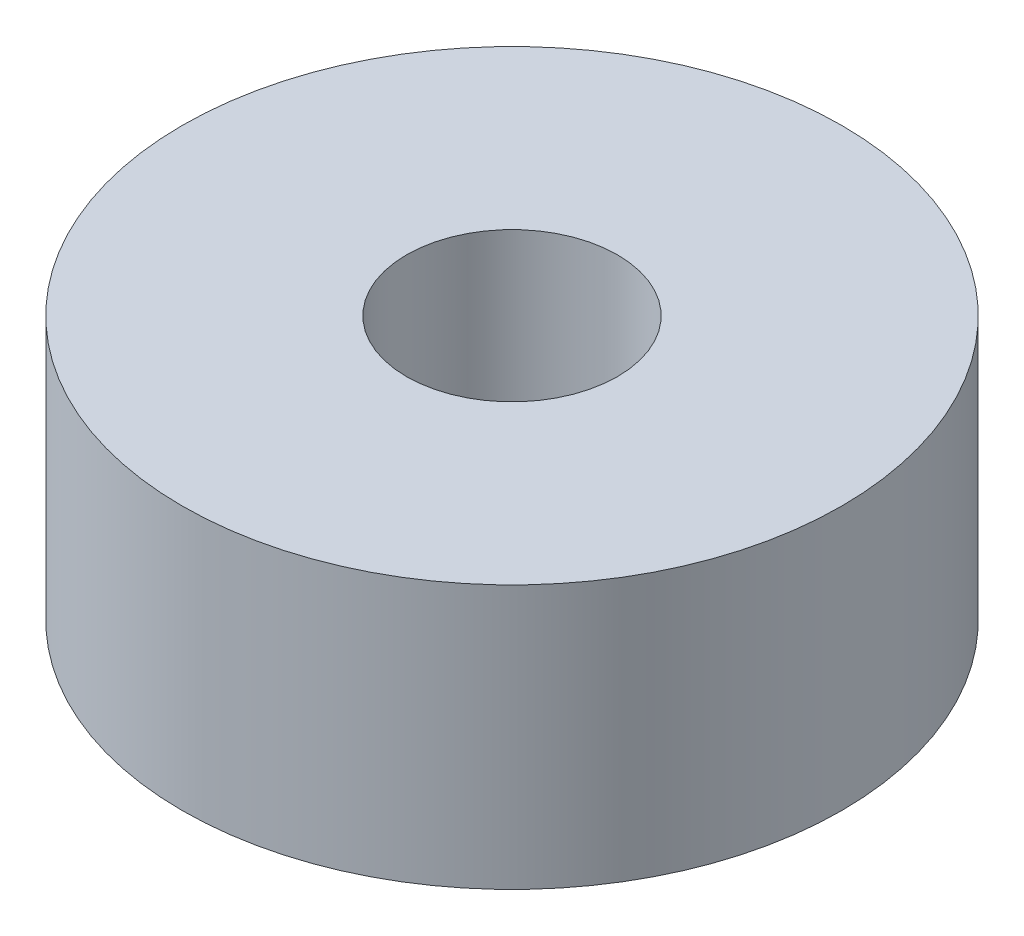
from build123d import *

# Parameters (mm, degrees)
SKETCH_1_R          = 2.5
EXTRUDE_1_DEPTH     = 2
SKETCH_2_R          = 0.8
CUT_EXTRUDE_1_DEPTH = 5.062019202


with BuildPart() as part:
    # 草图1 → 凸台-拉伸1 (new body)
    with BuildSketch(Plane(origin=(0, 0, 0), x_dir=(1, 0, 0), z_dir=(0, 1, 0))):
        with Locations(Location((0, 0, 0), (0, 0, 270))):
            Circle(SKETCH_1_R)
    extrude(amount=EXTRUDE_1_DEPTH)

    # 草图2 → 切除-拉伸1 (cut, through all)
    with BuildSketch(Plane(origin=(0, 2, 0), x_dir=(1, 0, 0), z_dir=(0, 1, 0))):
        with Locations(Location((0, 0, 0), (0, 0, 270))):
            Circle(SKETCH_2_R)
    extrude(amount=-CUT_EXTRUDE_1_DEPTH, mode=Mode.SUBTRACT)


solid = part.part
